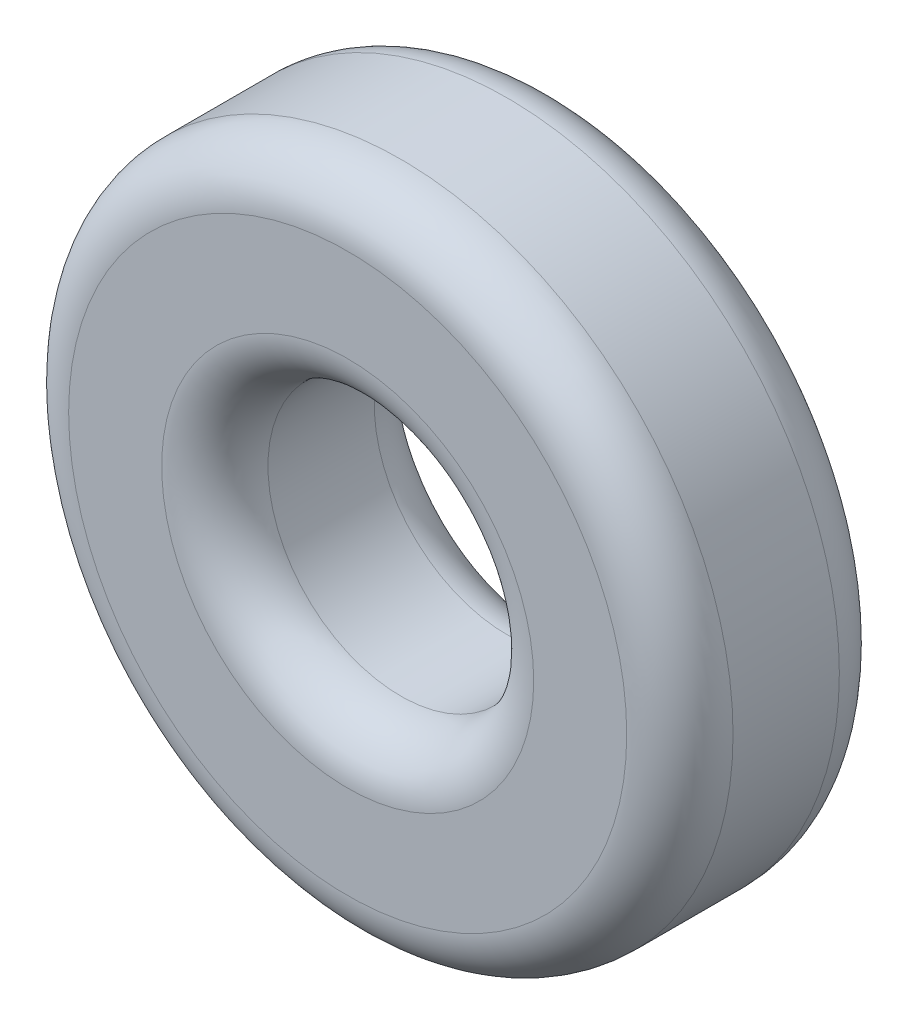
from build123d import *

# Parameters (mm, degrees)
SKETCH_1_R      = 12.5
SKETCH_1_R_2    = 5
EXTRUDE_1_DEPTH = 8
FILLET_1_R      = 2


with BuildPart() as part:
    # Эскиз1 → Вытянуть1 (new body)
    with BuildSketch(Plane.XY):
        Circle(SKETCH_1_R)
        Circle(SKETCH_1_R_2, mode=Mode.SUBTRACT)
    extrude(amount=EXTRUDE_1_DEPTH)

    # Скругление1
    fillet_1_edges = [part.edges().sort_by_distance(p)[0] for p in [
        (-12.5, 0, 0),
        (-12.5, 0, 8),
        (-5, 0, 0),
        (-5, 0, 8),
    ]]
    fillet(fillet_1_edges, radius=FILLET_1_R)


solid = part.part
